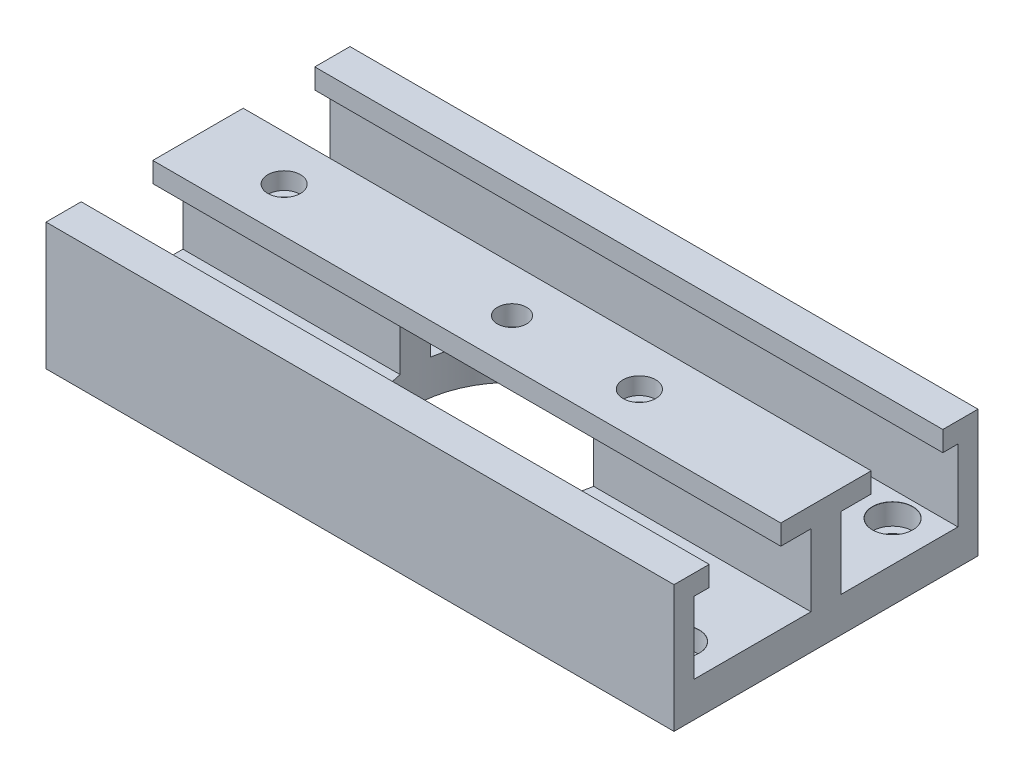
from build123d import *

# Parameters (mm, degrees)
BOSS_EXTRUDE1_DEPTH                                 = 125
CUT_EXTRUDE1_REACH                                  = 133.073
SKETCH4_R                                           = 19.5
SKETCH4_R_2                                         = 2.9
CUT_EXTRUDE2_DEPTH                                  = 132.07308076
CUT_EXTRUDE2_DEPTH_BACK                             = 132.07308076
SKETCH4_2_R                                         = 2.9
CBORE_FOR_M4_HEX_SOCKET_HEAD_CAP_SCR_2_COUNT        = 2
CBORE_FOR_M4_HEX_SOCKET_HEAD_CAP_SCR_2_PITCH        = 42.5
CBORE_FOR_M4_HEX_SOCKET_HEAD_CAP_SCR_3_COUNT        = 2
CBORE_FOR_M4_HEX_SOCKET_HEAD_CAP_SCR_3_PITCH        = 116.992521128
CBORE_FOR_M4_HEX_SOCKET_HEAD_CAP_SCR_4_COUNT        = 2
CBORE_FOR_M4_HEX_SOCKET_HEAD_CAP_SCR_4_PITCH        = 109
CBORE_FOR_M4_HEX_SOCKET_HEAD_CAP_SCR_5_COUNT        = 2
CBORE_FOR_M4_HEX_SOCKET_HEAD_CAP_SCR_5_PITCH        = 89
CBORE_FOR_M4_HEX_SOCKET_HEAD_CAP_SCR_6_COUNT        = 2
CBORE_FOR_M4_HEX_SOCKET_HEAD_CAP_SCR_6_PITCH        = 20
CBORE_FOR_M4_HEX_SOCKET_HEAD_CAP_SCR_7_COUNT        = 2
CBORE_FOR_M4_HEX_SOCKET_HEAD_CAP_SCR_7_PITCH        = 46.97073557
CBORE_FOR_M4_HEX_SOCKET_HEAD_CAP_SCR_8_COUNT        = 2
CBORE_FOR_M4_HEX_SOCKET_HEAD_CAP_SCR_8_PITCH        = 98.62682191
CBORE_FOR_M3_HEX_SOCKET_HEAD_CAP_SCREW1_D           = 3.4
CBORE_FOR_M3_HEX_SOCKET_HEAD_CAP_SCREW1_CBORE_D     = 6.5
CBORE_FOR_M3_HEX_SOCKET_HEAD_CAP_SCREW1_CBORE_DEPTH = 3.4


with BuildPart() as part:
    # Sketch2 → Boss-Extrude1 (new body)
    with BuildSketch(Plane(origin=(0, 0, 0), x_dir=(0, 0, -1), z_dir=(1, 0, 0))):
        Polygon((0, 0), (-30.25, 0), (-30.25, 25.3), (-23.25, 25.3), (-23.25, 21.3), (-26.25, 21.3), (-26.25, 7), (-3, 7), (-3, 21.3), (-9, 21.3), (-9, 25.3), (0, 25.3), align=None)
    boss_extrude1 = extrude(amount=BOSS_EXTRUDE1_DEPTH)

    # Mirror1: Boss-Extrude1 across plane
    add(boss_extrude1.mirror(Plane.XY))

    # Cut-Extrude1: up to this face of the body (flat: up to its plane)
    cut_extrude1_end = Plane(part.part.faces().sort_by_distance((62.5, 21.3, 6))[0])
    # Sketch4 → Cut-Extrude1 (cut, up to the picked face)
    with BuildSketch(Plane(origin=(0, 0, 0), x_dir=(-1, 0, 0), z_dir=(0, -1, 0)), mode=Mode.PRIVATE) as cut_extrude1_sk1:
        with Locations(Location((-62.5, 0, 0), (0, 0, 90))):
            Circle(SKETCH4_R)
        with Locations(Location((-62.5, 0, 0), (0, 0, 90))):
            Circle(SKETCH4_R_2, mode=Mode.SUBTRACT)
    cut_extrude1_tool1 = split(extrude(cut_extrude1_sk1.sketch, amount=-CUT_EXTRUDE1_REACH, mode=Mode.PRIVATE), bisect_by=cut_extrude1_end, keep=Keep.BOTH, mode=Mode.PRIVATE)
    add(cut_extrude1_tool1.solids().sort_by(Axis((62.5, 0, 18.948457), (0, 1, 0)))[0], mode=Mode.SUBTRACT)

    # Sketch4<2> → Cut-Extrude2 (cut, two sides: drawn at the far end of the back side and taken through both)
    with BuildSketch(Plane(origin=(0, 0, 0), x_dir=(-1, 0, 0), z_dir=(0, -1, 0)).offset(-CUT_EXTRUDE2_DEPTH_BACK)):
        with Locations(Location((-62.5, 0, 0), (0, 0, 90))):
            Circle(SKETCH4_2_R)
    extrude(amount=CUT_EXTRUDE2_DEPTH + CUT_EXTRUDE2_DEPTH_BACK, mode=Mode.SUBTRACT)

    # Sketch6 → CBORE for M4 Hex Socket Head Cap Screw1 (revolve, cut)
    with BuildSketch(Plane(origin=(117, 7, 21.25), x_dir=(0, 0, 1), z_dir=(1, 0, 0))):
        Polygon((0, 0), (0, 7), (2.25, 7), (2.25, 4.2), (4, 4.2), (4, 0.025), (4.025, 0), align=None)
    cbore_for_m4_hex_socket_head_cap_screw1 = revolve(axis=Axis((117, 13.35, 21.25), (0, -1, 0)), mode=Mode.SUBTRACT)

    # CBORE for M4 Hex Socket Head Cap Scr 2: CBORE for M4 Hex Socket Head Cap Screw1 ×2
    with Locations(*[(0, 0, -i * CBORE_FOR_M4_HEX_SOCKET_HEAD_CAP_SCR_2_PITCH) for i in range(1, CBORE_FOR_M4_HEX_SOCKET_HEAD_CAP_SCR_2_COUNT)]):
        add(cbore_for_m4_hex_socket_head_cap_screw1, mode=Mode.SUBTRACT)

    # CBORE for M4 Hex Socket Head Cap Scr 3: CBORE for M4 Hex Socket Head Cap Screw1 ×2
    with Locations(*[Vector(-0.9316834866759449, 0, -0.3632710842543822) * (i * CBORE_FOR_M4_HEX_SOCKET_HEAD_CAP_SCR_3_PITCH) for i in range(1, CBORE_FOR_M4_HEX_SOCKET_HEAD_CAP_SCR_3_COUNT)]):
        add(cbore_for_m4_hex_socket_head_cap_screw1, mode=Mode.SUBTRACT)

    # CBORE for M4 Hex Socket Head Cap Scr 4: CBORE for M4 Hex Socket Head Cap Screw1 ×2
    with Locations(*[(-i * CBORE_FOR_M4_HEX_SOCKET_HEAD_CAP_SCR_4_PITCH, 0, 0) for i in range(1, CBORE_FOR_M4_HEX_SOCKET_HEAD_CAP_SCR_4_COUNT)]):
        add(cbore_for_m4_hex_socket_head_cap_screw1, mode=Mode.SUBTRACT)

    # CBORE for M4 Hex Socket Head Cap Scr 5: CBORE for M4 Hex Socket Head Cap Screw1 ×2
    with Locations(*[(-i * CBORE_FOR_M4_HEX_SOCKET_HEAD_CAP_SCR_5_PITCH, 0, 0) for i in range(1, CBORE_FOR_M4_HEX_SOCKET_HEAD_CAP_SCR_5_COUNT)]):
        add(cbore_for_m4_hex_socket_head_cap_screw1, mode=Mode.SUBTRACT)

    # CBORE for M4 Hex Socket Head Cap Scr 6: CBORE for M4 Hex Socket Head Cap Screw1 ×2
    with Locations(*[(-i * CBORE_FOR_M4_HEX_SOCKET_HEAD_CAP_SCR_6_PITCH, 0, 0) for i in range(1, CBORE_FOR_M4_HEX_SOCKET_HEAD_CAP_SCR_6_COUNT)]):
        add(cbore_for_m4_hex_socket_head_cap_screw1, mode=Mode.SUBTRACT)

    # CBORE for M4 Hex Socket Head Cap Scr 7: CBORE for M4 Hex Socket Head Cap Screw1 ×2
    with Locations(*[Vector(-0.4257970363298798, 0, -0.904818702200994) * (i * CBORE_FOR_M4_HEX_SOCKET_HEAD_CAP_SCR_7_PITCH) for i in range(1, CBORE_FOR_M4_HEX_SOCKET_HEAD_CAP_SCR_7_COUNT)]):
        add(cbore_for_m4_hex_socket_head_cap_screw1, mode=Mode.SUBTRACT)

    # CBORE for M4 Hex Socket Head Cap Scr 8: CBORE for M4 Hex Socket Head Cap Screw1 ×2
    with Locations(*[Vector(-0.9023914415646597, 0, -0.43091726142132625) * (i * CBORE_FOR_M4_HEX_SOCKET_HEAD_CAP_SCR_8_PITCH) for i in range(1, CBORE_FOR_M4_HEX_SOCKET_HEAD_CAP_SCR_8_COUNT)]):
        add(cbore_for_m4_hex_socket_head_cap_screw1, mode=Mode.SUBTRACT)

    # CBORE for M3 Hex Socket Head Cap Screw1 (through all)
    with Locations(Plane(origin=(0, 25.3, 0), x_dir=(1, 0, 0), z_dir=(0, 1, 0))):
        with Locations((87.849101299, 0), (17.150898701, 0)):
            CounterBoreHole(CBORE_FOR_M3_HEX_SOCKET_HEAD_CAP_SCREW1_D / 2, CBORE_FOR_M3_HEX_SOCKET_HEAD_CAP_SCREW1_CBORE_D / 2, CBORE_FOR_M3_HEX_SOCKET_HEAD_CAP_SCREW1_CBORE_DEPTH)


solid = part.part
